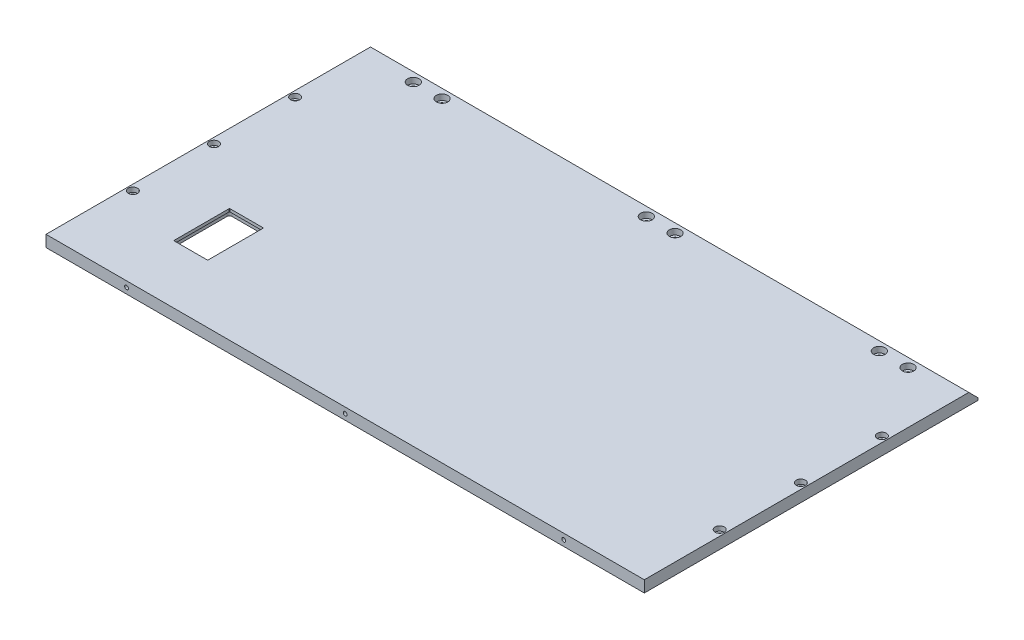
from build123d import *

# Parameters (mm, degrees)
SKETCH1_W                      = 520
SKETCH1_H                      = 290
BOSS_EXTRUDE1_DEPTH            = 10
CBORE_FOR_M5_SHCS1_D           = 5.5
CBORE_FOR_M5_SHCS1_DEPTH       = 11.5
CBORE_FOR_M5_SHCS1_CBORE_D     = 10
CBORE_FOR_M5_SHCS1_CBORE_DEPTH = 5
CBORE_FOR_M5_SHCS1_TIP         = 1.652366702
CUT_EXTRUDE1_DEPTH             = 390.615194776
CUT_EXTRUDE1_DEPTH_BACK        = 390.615194776
CBORE_FOR_M4_SHCS1_D           = 4.5
CBORE_FOR_M4_SHCS1_CBORE_D     = 8
CBORE_FOR_M4_SHCS1_CBORE_DEPTH = 4
M4X0_7_TAPPED_HOLE1_D          = 3.3
M4X0_7_TAPPED_HOLE1_DEPTH      = 12
M4X0_7_TAPPED_HOLE1_TIP        = 0.991420021
SKETCH9_W                      = 29.5
SKETCH9_H                      = 48.5
CUT_EXTRUDE2_DEPTH             = 390.615194776
FILLET1_R                      = 0.5
SKETCH10_W                     = 39.5
SKETCH10_H                     = 58.5
CUT_EXTRUDE3_DEPTH             = 7.5
FILLET2_R                      = 2
M4X0_7_TAPPED_HOLE2_D          = 3.3
M4X0_7_TAPPED_HOLE2_DEPTH      = 8
M4X0_7_TAPPED_HOLE2_TIP        = 0.991420021


with BuildPart() as part:
    # Sketch1 → Boss-Extrude1 (new body)
    with BuildSketch(Plane(origin=(0, 0, 0), x_dir=(1, 0, 0), z_dir=(0, 1, 0))):
        with Locations((0, 145)):
            Rectangle(SKETCH1_W, SKETCH1_H)
    extrude(amount=BOSS_EXTRUDE1_DEPTH)

    # CBORE for M5 SHCS1
    with Locations(Plane(origin=(0, 10, 0), x_dir=(1, 0, 0), z_dir=(0, 1, 0))):
        with Locations((-215, 274.25), (-190, 274.25), (-12.5, 274.25), (12.5, 274.25), (190, 274.25), (215, 274.25)):
            CounterBoreHole(CBORE_FOR_M5_SHCS1_D / 2, CBORE_FOR_M5_SHCS1_CBORE_D / 2, CBORE_FOR_M5_SHCS1_CBORE_DEPTH, depth=CBORE_FOR_M5_SHCS1_DEPTH)
            with Locations((0, 0, -(CBORE_FOR_M5_SHCS1_DEPTH + CBORE_FOR_M5_SHCS1_TIP / 2))):  # 118° drill point
                Cone(0, CBORE_FOR_M5_SHCS1_D / 2, CBORE_FOR_M5_SHCS1_TIP, mode=Mode.SUBTRACT)

    # Sketch2 → Cut-Extrude1 (cut, two sides: drawn at the far end of the back side and taken through both)
    with BuildSketch(Plane(origin=(0, 0, 0), x_dir=(0, 0, -1), z_dir=(1, 0, 0)).offset(-CUT_EXTRUDE1_DEPTH_BACK)):
        Polygon((290, 2), (290, 10), (282, 10), align=None)
    extrude(amount=CUT_EXTRUDE1_DEPTH + CUT_EXTRUDE1_DEPTH_BACK, mode=Mode.SUBTRACT)

    # CBORE for M4 SHCS1 (through all)
    with Locations(Plane(origin=(0, 10, 0), x_dir=(1, 0, 0), z_dir=(0, 1, 0))):
        with Locations((255, 211.5), (255, 141), (255, 70.5)):
            cbore_for_m4_shcs1 = CounterBoreHole(CBORE_FOR_M4_SHCS1_D / 2, CBORE_FOR_M4_SHCS1_CBORE_D / 2, CBORE_FOR_M4_SHCS1_CBORE_DEPTH)

    # Mirror1: CBORE for M4 SHCS1 across plane
    add(cbore_for_m4_shcs1.mirror(Plane(origin=(0, 0, 0), x_dir=(0, 0, 1), z_dir=(1, 0, 0))), mode=Mode.SUBTRACT)

    # M4x0.7 Tapped Hole1
    with Locations(Plane.XY):
        with Locations((-190, 5), (0, 5), (190, 5)):
            Hole(M4X0_7_TAPPED_HOLE1_D / 2, depth=M4X0_7_TAPPED_HOLE1_DEPTH)
            with Locations((0, 0, -(M4X0_7_TAPPED_HOLE1_DEPTH + M4X0_7_TAPPED_HOLE1_TIP / 2))):  # 118° drill point
                Cone(0, M4X0_7_TAPPED_HOLE1_D / 2, M4X0_7_TAPPED_HOLE1_TIP, mode=Mode.SUBTRACT)

    # Sketch9 → Cut-Extrude2 (cut, through all)
    with BuildSketch(Plane(origin=(0, 10, 0), x_dir=(1, 0, 0), z_dir=(0, 1, 0))):
        with Locations((-185, 75)):
            Rectangle(SKETCH9_W, SKETCH9_H)
    extrude(amount=-CUT_EXTRUDE2_DEPTH, mode=Mode.SUBTRACT)

    # Fillet1
    fillet1_edges = [part.edges().sort_by_distance(p)[0] for p in [
        (-170.25, 5, -99.25),
        (-170.25, 5, -50.75),
        (-199.75, 5, -50.75),
        (-199.75, 5, -99.25),
    ]]
    fillet(fillet1_edges, radius=FILLET1_R)

    # Sketch10 → Cut-Extrude3 (cut)
    with BuildSketch(Plane.XZ):
        with Locations((-185, -75)):
            Rectangle(SKETCH10_W, SKETCH10_H)
    extrude(amount=-CUT_EXTRUDE3_DEPTH, mode=Mode.SUBTRACT)

    # Fillet2
    fillet2_edges = [part.edges().sort_by_distance(p)[0] for p in [
        (-165.25, 3.75, -45.75),
        (-165.25, 3.75, -104.25),
        (-204.75, 3.75, -104.25),
        (-204.75, 3.75, -45.75),
    ]]
    fillet(fillet2_edges, radius=FILLET2_R)

    # M4x0.7 Tapped Hole2
    with Locations(Plane(origin=(0, 0, 0), x_dir=(-1, 0, 0), z_dir=(0, -1, 0))):
        with Locations((99.4, 175), (210, 175), (210, 140), (99.4, 140)):
            Hole(M4X0_7_TAPPED_HOLE2_D / 2, depth=M4X0_7_TAPPED_HOLE2_DEPTH)
            with Locations((0, 0, -(M4X0_7_TAPPED_HOLE2_DEPTH + M4X0_7_TAPPED_HOLE2_TIP / 2))):  # 118° drill point
                Cone(0, M4X0_7_TAPPED_HOLE2_D / 2, M4X0_7_TAPPED_HOLE2_TIP, mode=Mode.SUBTRACT)


solid = part.part
